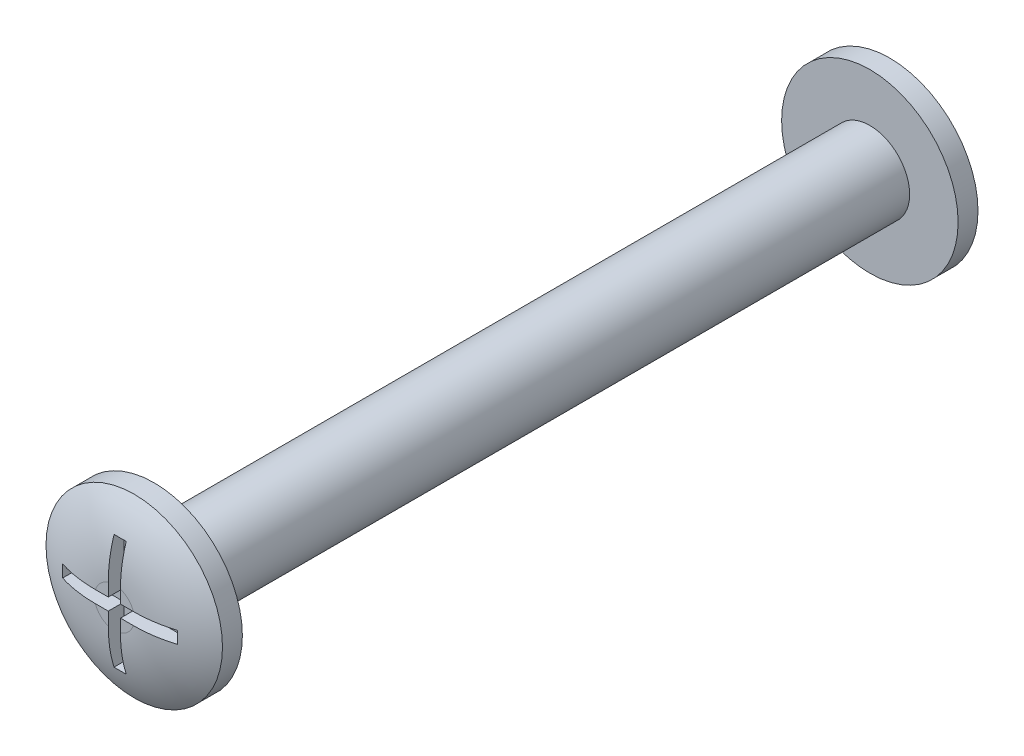
from build123d import *

# Parameters (mm, degrees)
SKETCH2_W          = 9.186415934
SKETCH2_H          = 0.97118121
SKETCH2_W_2        = 0.97118121
SKETCH2_H_2        = 9.186415934
CUT_EXTRUDE1_DEPTH = 1.27


with BuildPart() as part:
    # Sketch1 → Revolve1 (revolve)
    with BuildSketch(Plane(origin=(0, 0, 0), x_dir=(1, 0, 0), z_dir=(0, 1, 0))):
        with BuildLine():
            Line((0, 57.15), (0, 0))
            Line((0, 0), (0, -3.175))
            Line((0, -3.175), (1.5875, -3.175))
            ThreePointArc((1.5875, -3.175), (4.429777637, -2.770069708), (7.045889178, -1.5875))
            Line((7.045889178, -1.5875), (7.045889178, 0))
            Line((7.045889178, 0), (3.175, 0))
            Line((3.175, 0), (3.175, 57.15))
            Line((3.175, 57.15), (7.045889178, 57.15))
            Line((7.045889178, 57.15), (7.045889178, 58.7375))
            ThreePointArc((7.045889178, 58.7375), (4.429777637, 59.920069708), (1.5875, 60.325))
            Line((1.5875, 60.325), (0, 60.325))
            Line((0, 60.325), (0, 57.15))
        make_face()
    revolve(axis=Axis((0, 0, 0), (0, 0, -1)))

    # Sketch2 → Cut-Extrude1 (cut)
    with BuildSketch(Plane.XY.offset(3.175)):
        Rectangle(SKETCH2_W, SKETCH2_H)
        Rectangle(SKETCH2_W_2, SKETCH2_H_2)
    cut_extrude1 = extrude(amount=-CUT_EXTRUDE1_DEPTH, mode=Mode.SUBTRACT)

    # Mirror1: Cut-Extrude1 across plane
    add(cut_extrude1.mirror(Plane(origin=(0, 0, -28.575), x_dir=(1, 0, 0), z_dir=(0, 0, -1))), mode=Mode.SUBTRACT)


solid = part.part
